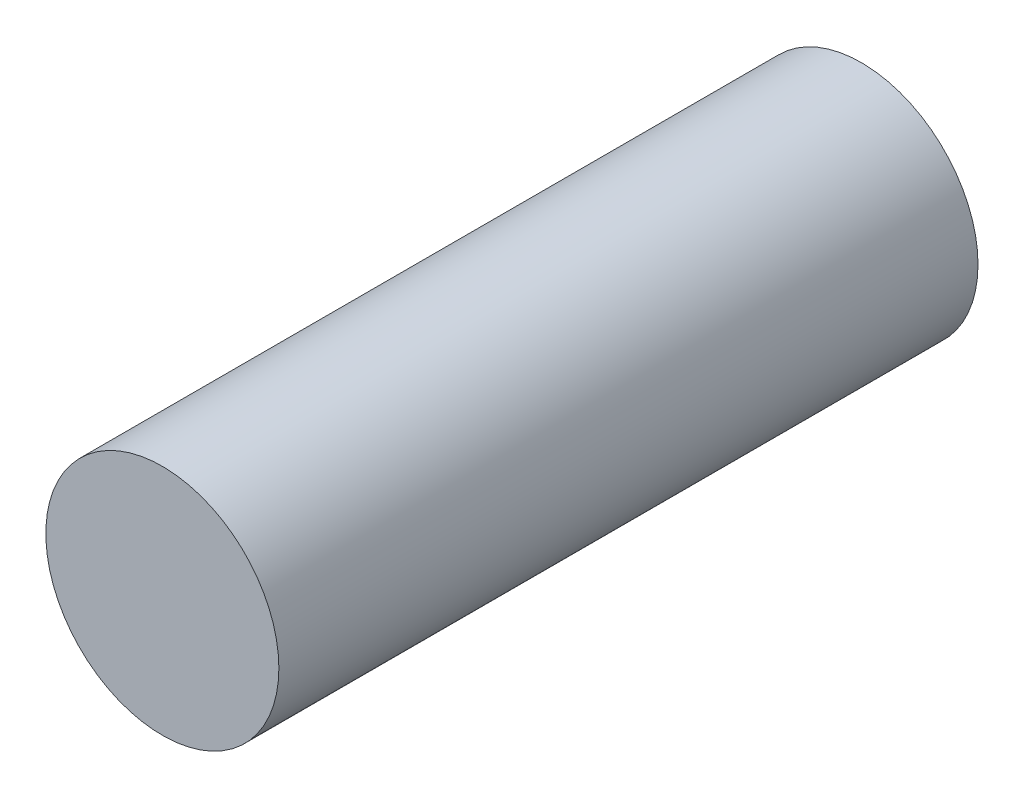
from build123d import *

# Parameters (mm, degrees)
SKETCH1_R           = 10
BOSS_EXTRUDE1_DEPTH = 60


with BuildPart() as part:
    # Sketch1 → Boss-Extrude1 (new body)
    with BuildSketch(Plane.XY):
        Circle(SKETCH1_R)
    extrude(amount=BOSS_EXTRUDE1_DEPTH)


solid = part.part
